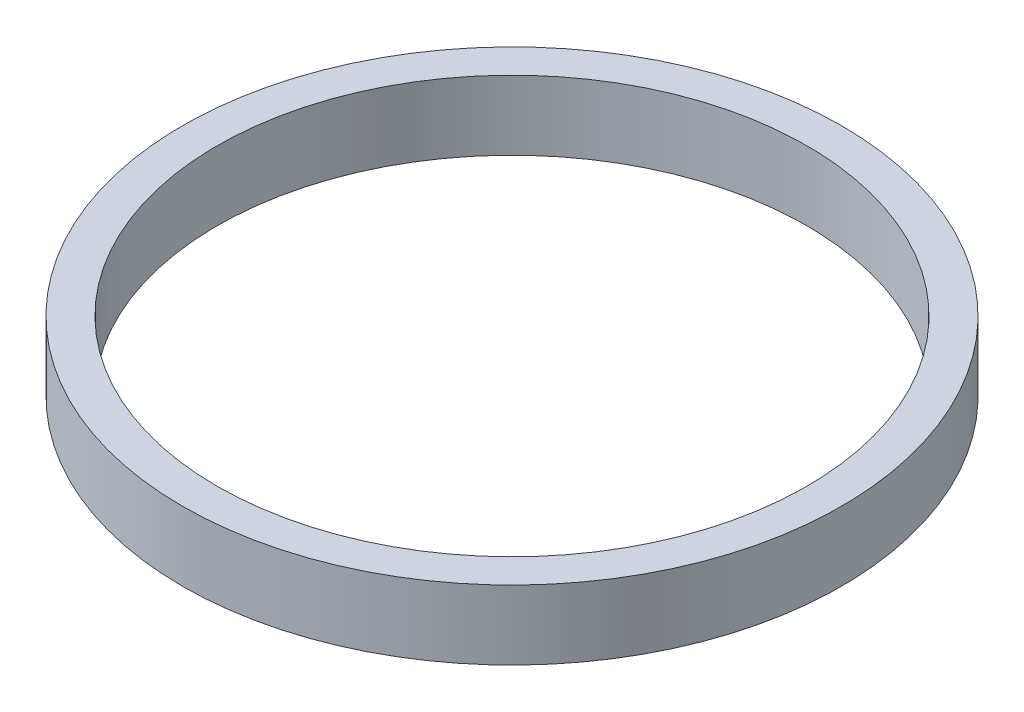
from build123d import *

# Parameters (mm, degrees)
SKETCH1_R           = 47.55
SKETCH1_R_2         = 42.55
BOSS_EXTRUDE1_DEPTH = 10


with BuildPart() as part:
    # Sketch1 → Boss-Extrude1 (new body)
    with BuildSketch(Plane(origin=(0, 0, 0), x_dir=(1, 0, 0), z_dir=(0, 1, 0))):
        with Locations(Location((0, 0, 0), (0, 0, 270))):
            Circle(SKETCH1_R)
        with Locations(Location((0, 0, 0), (0, 0, 270))):
            Circle(SKETCH1_R_2, mode=Mode.SUBTRACT)
    extrude(amount=BOSS_EXTRUDE1_DEPTH)


solid = part.part
